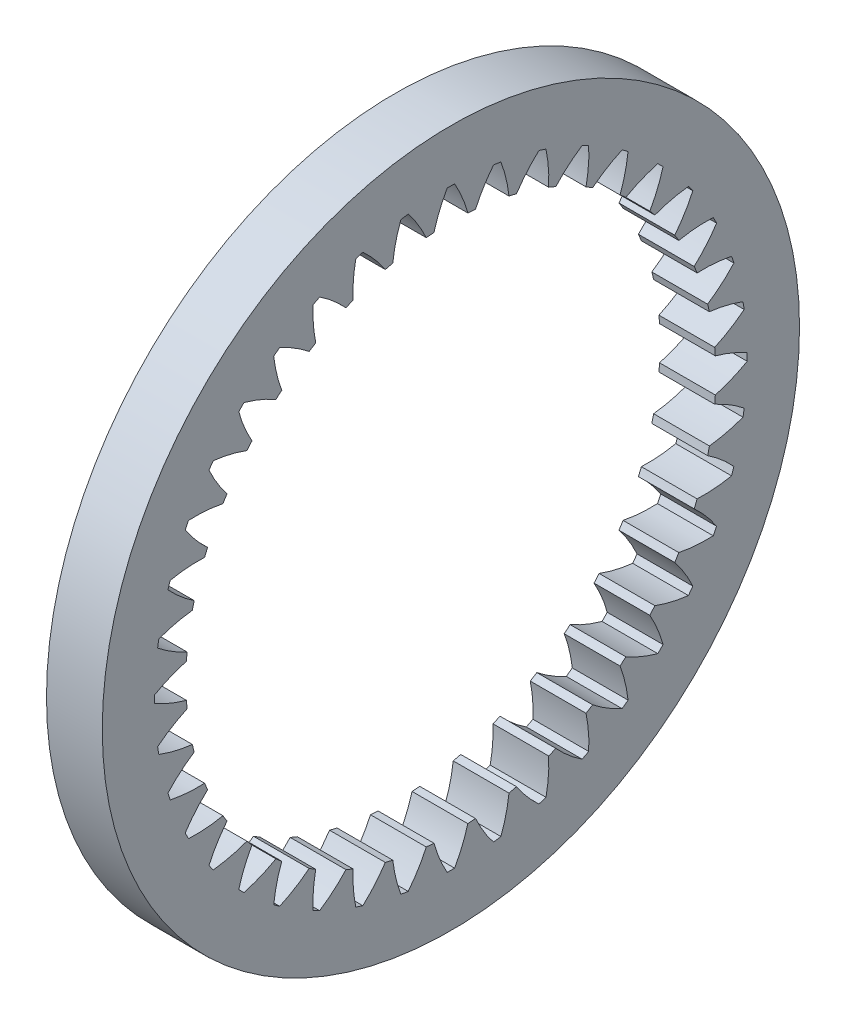
from build123d import *

# Parameters (mm, degrees)
BASPROSKE_W     = 6
BASPROSKE_H     = 9
TOOTHCUT_DEPTH  = 54.371340624
TEETHCUTS_COUNT = 40
TEETHCUTS_ANGLE = 351


with BuildPart() as part:
    # BasProSke → Base-Revolve (revolve)
    with BuildSketch(Plane(origin=(0, 0, 0), x_dir=(1, 0, 0), z_dir=(0, 1, 0)), mode=Mode.PRIVATE) as base_revolve_sk:
        with Locations((3, 33)):
            Rectangle(BASPROSKE_W, BASPROSKE_H)
    revolve(base_revolve_sk.sketch.rotate(Axis((-10, 0, 0), (1, 0, 0)), 180), axis=Axis((-10, 0, 0), (1, 0, 0)))

    # TooCutSke → ToothCut (cut, through all)
    with BuildSketch(Plane(origin=(0, 0, 0), x_dir=(0, 0, -1), z_dir=(1, 0, 0))):
        with BuildLine():
            ThreePointArc((1.829037691, 28.41579607), (1.222083787, 30.189429646), (0.39864463, 31.873507157))
            ThreePointArc((0.39864463, 31.873507157), (0, 31.876), (-0.39864463, 31.873507157))
            ThreePointArc((-0.39864463, 31.873507157), (-1.222083787, 30.189429646), (-1.829037691, 28.41579607))
            ThreePointArc((-1.829037691, 28.41579607), (0, 28.4746), (1.829037691, 28.41579607))
        make_face()
    toothcut = extrude(amount=TOOTHCUT_DEPTH, mode=Mode.SUBTRACT)

    # TeethCuts: ToothCut ×40 about axis
    teethcuts_axis = Axis((-10, 0, 0), (1, 0, 0))
    for i in range(1, TEETHCUTS_COUNT):
        add(toothcut.rotate(teethcuts_axis, i * TEETHCUTS_ANGLE / (TEETHCUTS_COUNT - 1)), mode=Mode.SUBTRACT)


solid = part.part
